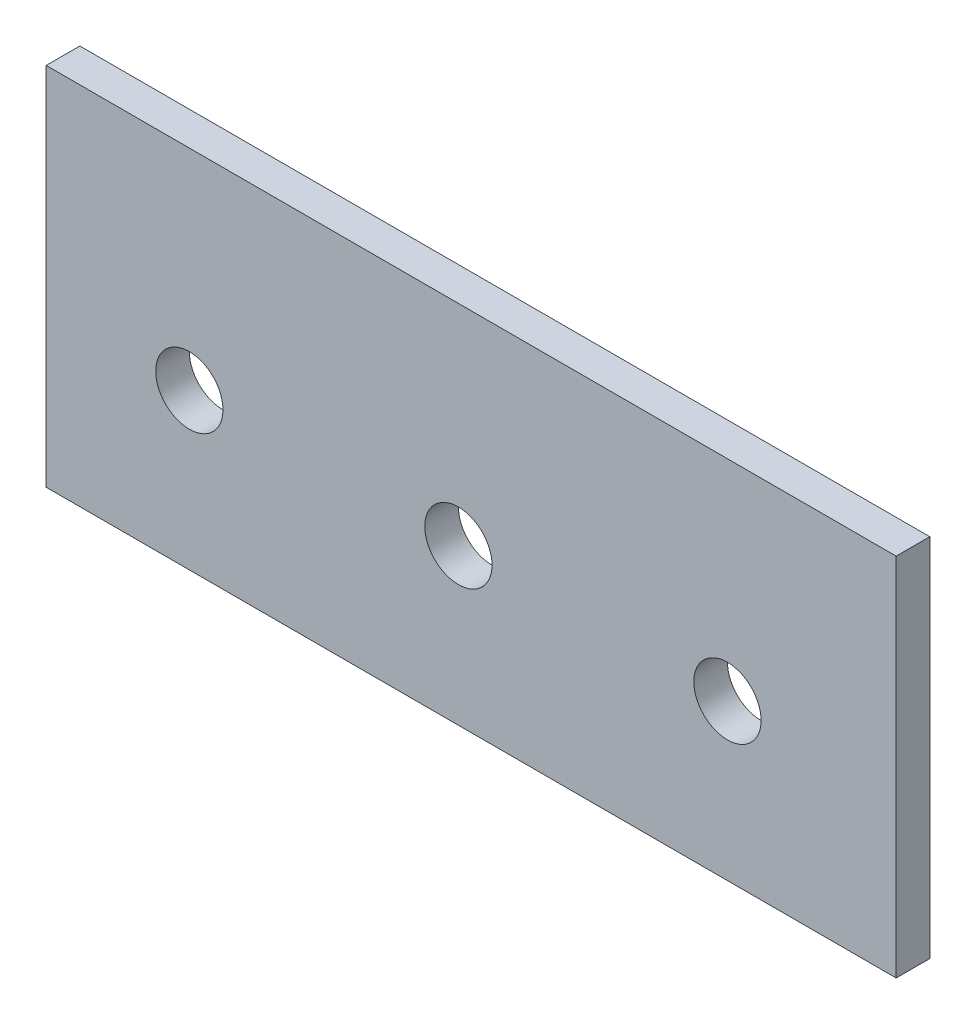
from build123d import *

# Parameters (mm, degrees)
SKETCH1_W           = 80.235006911
SKETCH1_H           = 34.488789304
SKETCH1_R           = 3.175
BOSS_EXTRUDE1_DEPTH = 3.175


with BuildPart() as part:
    # Sketch1 → Boss-Extrude1 (new body)
    with BuildSketch(Plane.XY):
        with Locations((-49.593219406, 2.56884022)):
            Rectangle(SKETCH1_W, SKETCH1_H)
        with Locations((-76.2, 0)):
            Circle(SKETCH1_R, mode=Mode.SUBTRACT)
        with Locations((-25.4, 0)):
            Circle(SKETCH1_R, mode=Mode.SUBTRACT)
        with Locations((-50.8, 0)):
            Circle(SKETCH1_R, mode=Mode.SUBTRACT)
    extrude(amount=BOSS_EXTRUDE1_DEPTH)


solid = part.part
